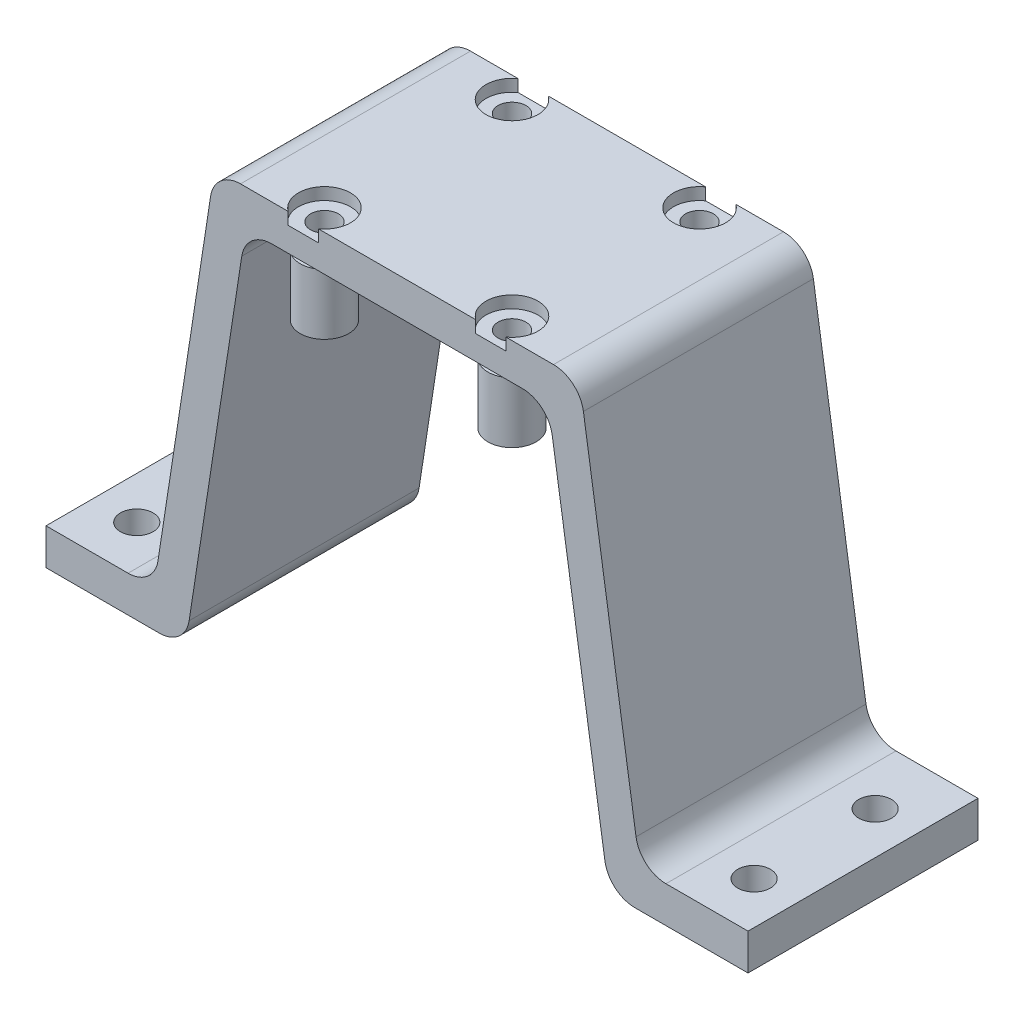
from build123d import *

# Parameters (mm, degrees)
EXTRUDE_1_DEPTH     = 9.5
SKETCH_2_R          = 1.15
CUT_EXTRUDE_1_DEPTH = 45.58138625
EXTRUDE_START       = 5
SKETCH_3_R          = 2
SKETCH_3_R_2        = 1.15
EXTRUDE_2_DEPTH     = 5
SKETCH_4_R          = 1.35
CUT_EXTRUDE_2_DEPTH = 45.634672722
FILLET_1_R          = 2.5
SKETCH_5_R          = 2.15
CUT_EXTRUDE_3_DEPTH = 1


with BuildPart() as part:
    # 草图1 → 凸台-拉伸1 (new, symmetric)
    with BuildSketch(Plane.XY):
        Polygon((-20.07375687, 0), (-15.07375687, 32.5), (15.07375687, 32.5), (20.07375687, 0), (29, 0), (29, -3), (17.5, -3), (12.5, 29.5), (-12.5, 29.5), (-17.5, -3), (-29, -3), (-29, 0), align=None)
    extrude(amount=EXTRUDE_1_DEPTH, both=True)

    # 草图2 → 切除-拉伸1 (cut, through all)
    with BuildSketch(Plane.XZ.offset(-29.5)):
        with Locations(Location((-7.747, 7.747, 0), (0, 0, 270))):
            Circle(SKETCH_2_R)
        with Locations(Location((7.747, 7.747, 0), (0, 0, 270))):
            Circle(SKETCH_2_R)
        with Locations(Location((7.747, -7.747, 0), (0, 0, 270))):
            Circle(SKETCH_2_R)
        with Locations(Location((-7.747, -7.747, 0), (0, 0, 270))):
            Circle(SKETCH_2_R)
    extrude(amount=-CUT_EXTRUDE_1_DEPTH, mode=Mode.SUBTRACT)

    # 草图3 → 凸台-拉伸2 (add)
    # profile 1 of 4: a face of its own
    with BuildSketch(Plane.XZ.offset(-29.5).offset(EXTRUDE_START)):
        with Locations(Location((-7.747, 7.747, 0), (0, 0, 118.776999733))):
            Circle(SKETCH_3_R)
        with Locations(Location((-7.747, 7.747, 0), (0, 0, 270))):
            Circle(SKETCH_3_R_2, mode=Mode.SUBTRACT)
    # profile 2 of 4: a face of its own
    with BuildSketch(Plane.XZ.offset(-29.5).offset(EXTRUDE_START)):
        with Locations(Location((7.747, 7.747, 0), (0, 0, 118.776999733))):
            Circle(SKETCH_3_R)
        with Locations(Location((7.747, 7.747, 0), (0, 0, 270))):
            Circle(SKETCH_3_R_2, mode=Mode.SUBTRACT)
    # profile 3 of 4: a face of its own
    with BuildSketch(Plane.XZ.offset(-29.5).offset(EXTRUDE_START)):
        with Locations(Location((7.747, -7.747, 0), (0, 0, 241.223000267))):
            Circle(SKETCH_3_R)
        with Locations(Location((7.747, -7.747, 0), (0, 0, 270))):
            Circle(SKETCH_3_R_2, mode=Mode.SUBTRACT)
    # profile 4 of 4: a face of its own
    with BuildSketch(Plane.XZ.offset(-29.5).offset(EXTRUDE_START)):
        with Locations(Location((-7.747, -7.747, 0), (0, 0, 241.223000267))):
            Circle(SKETCH_3_R)
        with Locations(Location((-7.747, -7.747, 0), (0, 0, 270))):
            Circle(SKETCH_3_R_2, mode=Mode.SUBTRACT)
    extrude(amount=-EXTRUDE_2_DEPTH)

    # 草图4 → 切除-拉伸2 (cut, through all)
    with BuildSketch(Plane(origin=(0, 0, 0), x_dir=(1, 0, 0), z_dir=(0, 1, 0))):
        with Locations(Location((-25.5, 4.5, 0), (0, 0, 180))):
            Circle(SKETCH_4_R)
        with Locations(Location((-25.5, -5.5, 0), (0, 0, 180))):
            Circle(SKETCH_4_R)
        with Locations(Location((25.5, 4.5, 0), (0, 0, 180))):
            Circle(SKETCH_4_R)
        with Locations(Location((25.5, -5.5, 0), (0, 0, 180))):
            Circle(SKETCH_4_R)
    extrude(amount=-CUT_EXTRUDE_2_DEPTH, mode=Mode.SUBTRACT)

    # 圆角1
    fillet_1_edges = [part.edges().sort_by_distance(p)[0] for p in [
        (-20.07375687, 0, 0),
        (-15.07375687, 32.5, 0),
        (15.07375687, 32.5, 0),
        (20.07375687, 0, 0),
        (17.5, -3, 0),
        (12.5, 29.5, 0),
        (-12.5, 29.5, 0),
        (-17.5, -3, 0),
    ]]
    fillet(fillet_1_edges, radius=FILLET_1_R)

    # 草图5 → 切除-拉伸3 (cut)
    with BuildSketch(Plane(origin=(0, 32.5, 0), x_dir=(1, 0, 0), z_dir=(0, 1, 0))):
        with Locations((-7.747, -7.747)):
            Circle(SKETCH_5_R)
        with Locations((7.747, -7.747)):
            Circle(SKETCH_5_R)
        with Locations((7.747, 7.747)):
            Circle(SKETCH_5_R)
        with Locations((-7.747, 7.747)):
            Circle(SKETCH_5_R)
    extrude(amount=-CUT_EXTRUDE_3_DEPTH, mode=Mode.SUBTRACT)


solid = part.part
